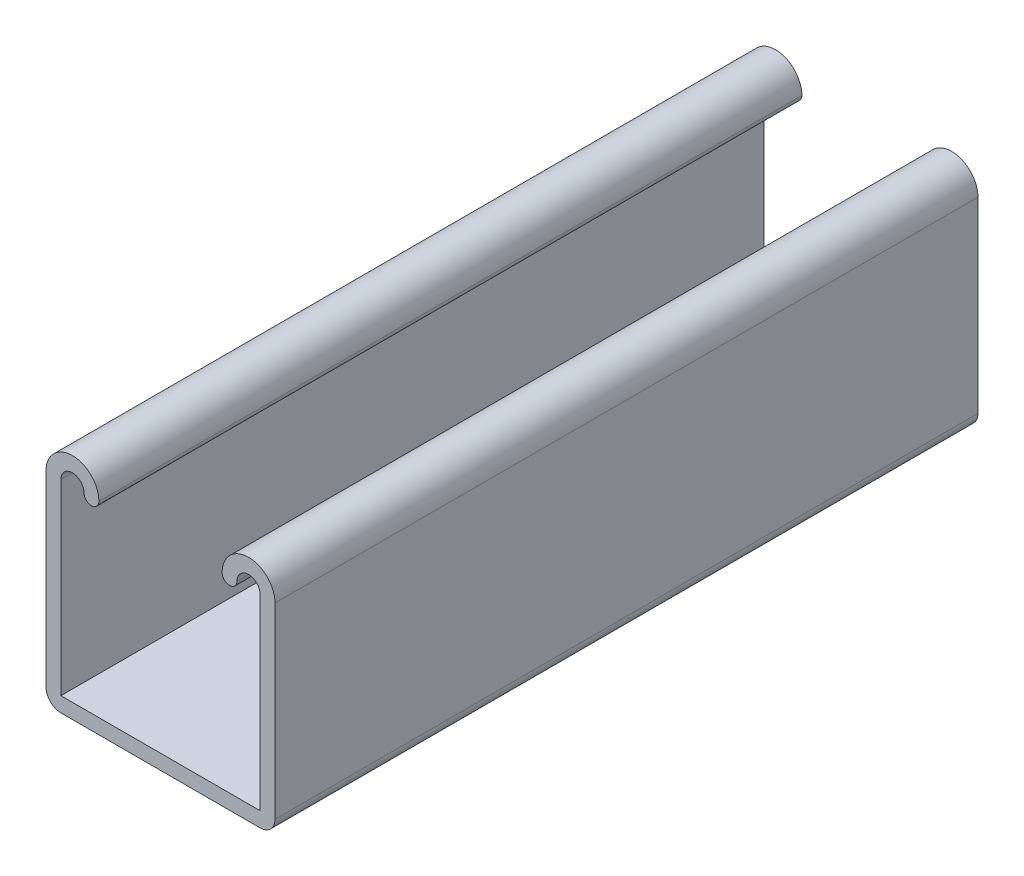
from build123d import *

# Parameters (mm, degrees)
BOSS_EXTRUDE1_DEPTH = 127


with BuildPart() as part:
    # Sketch1 → Boss-Extrude1 (new body)
    with BuildSketch(Plane.XY):
        with BuildLine():
            Line((0, 0), (35.98, 0))
            ThreePointArc((35.98, 0), (37.883814298, 0.788585702), (38.6724, 2.6924))
            Line((38.6724, 2.6924), (38.6724, 36.5252))
            ThreePointArc((38.6724, 36.5252), (33.8972, 41.3004), (29.122, 36.5252))
            ThreePointArc((29.122, 36.5252), (30.4682, 35.179), (31.8144, 36.5252))
            ThreePointArc((31.8144, 36.5252), (33.8972, 38.608), (35.98, 36.5252))
            Line((35.98, 36.5252), (35.98, 2.6924))
            Line((35.98, 2.6924), (0, 2.6924))
            Line((0, 2.6924), (0, 36.5252))
            ThreePointArc((0, 36.5252), (2.0828, 38.608), (4.1656, 36.5252))
            ThreePointArc((4.1656, 36.5252), (5.5118, 35.179), (6.858, 36.5252))
            ThreePointArc((6.858, 36.5252), (2.0828, 41.3004), (-2.6924, 36.5252))
            Line((-2.6924, 36.5252), (-2.6924, 2.6924))
            ThreePointArc((-2.6924, 2.6924), (-1.903814298, 0.788585702), (0, 0))
        make_face()
    extrude(amount=BOSS_EXTRUDE1_DEPTH)


solid = part.part
